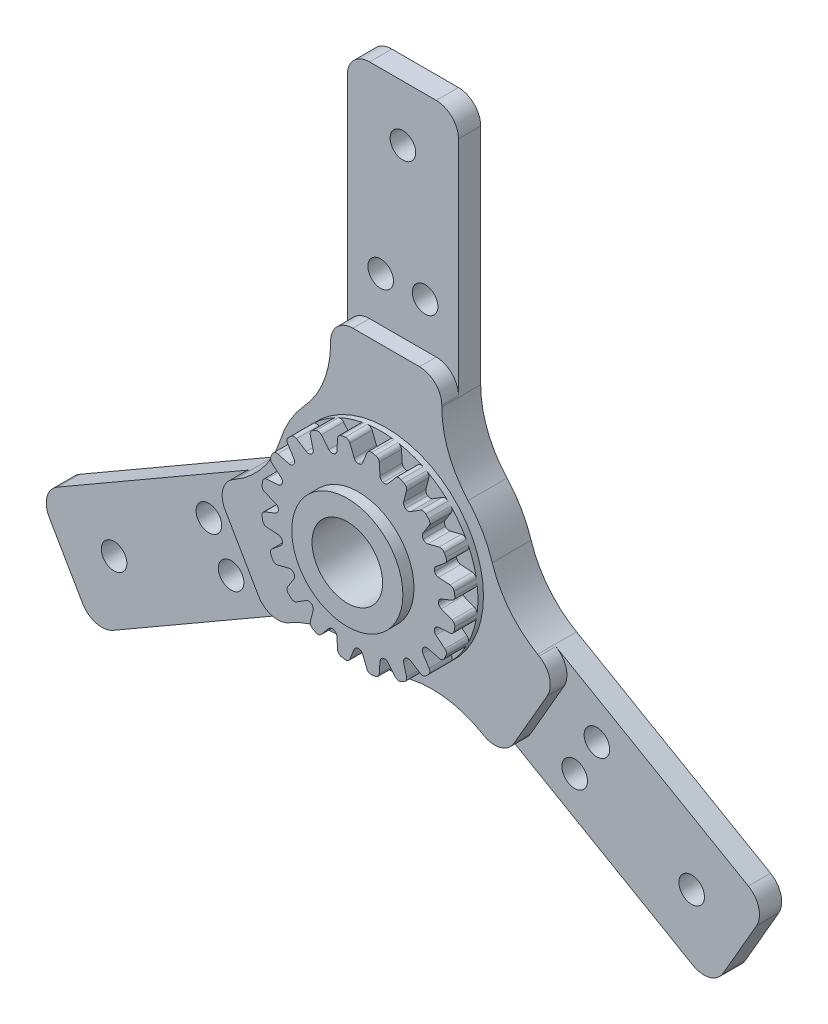
from build123d import *

# Parameters (mm, degrees)
SKETCH2_R          = 20
EXTRUDE2_DEPTH     = 7
SKETCH3_R          = 17.5
EXTRUDE3_DEPTH     = 5
SKETCH4_R          = 10
EXTRUDE4_DEPTH     = 2
SKETCH5_W          = 20
SKETCH5_H          = 69
EXTRUDE5_DEPTH     = 7
CIRPATTERN3_COUNT  = 3
FILLET1_R          = 18
CUT_EXTRUDE1_START = 4
SKETCH6_W          = 30
SKETCH6_H          = 45
CUT_EXTRUDE1_DEPTH = 7
CIRPATTERN4_COUNT  = 3
FILLET2_R          = 4
FILLET3_R          = 4
SKETCH7_R          = 2.3
CUT_EXTRUDE3_DEPTH = 7
CIRPATTERN5_COUNT  = 3
SKETCH9_R          = 6.35
CUT_EXTRUDE4_DEPTH = 16
CUT_EXTRUDE5_DEPTH = 4
CIRPATTERN6_COUNT  = 20
FILLET4_R          = 0.8


with BuildPart() as part:
    # Sketch2 → Extrude2 (new body)
    with BuildSketch(Plane.XY):
        Circle(SKETCH2_R)
    extrude(amount=EXTRUDE2_DEPTH)

    # Sketch3 → Extrude3 (add)
    with BuildSketch(Plane.XY.offset(7)):
        Circle(SKETCH3_R)
    extrude(amount=EXTRUDE3_DEPTH)

    # Sketch4 → Extrude4 (add)
    with BuildSketch(Plane.XY.offset(12)):
        Circle(SKETCH4_R)
    extrude(amount=EXTRUDE4_DEPTH)

    # Sketch5 → Extrude5 (add)
    with BuildSketch(Plane.XY):
        with Locations((0, 35.5)):
            Rectangle(SKETCH5_W, SKETCH5_H)
    extrude5 = extrude(amount=EXTRUDE5_DEPTH)

    # CirPattern3: Extrude5 ×3 about axis
    cirpattern3_axis = Axis((0, 0, 14), (0, 0, -1))
    for i in range(1, CIRPATTERN3_COUNT):
        add(extrude5.rotate(cirpattern3_axis, i * 360 / CIRPATTERN3_COUNT))

    # Fillet1
    fillet1_edges = [part.edges().sort_by_distance(p)[0] for p in [
        (-20, 0, 3.5),
        (-10, 17.320508076, 3.5),
        (10, 17.320508076, 3.5),
        (20, 0, 3.5),
        (10, -17.320508076, 3.5),
        (-10, -17.320508076, 3.5),
    ]]
    fillet(fillet1_edges, radius=FILLET1_R)

    # Sketch6 → Cut-Extrude1 (cut)
    with BuildSketch(Plane.XY.offset(CUT_EXTRUDE1_START)):
        with Locations((0, 52.5)):
            Rectangle(SKETCH6_W, SKETCH6_H)
    cut_extrude1 = extrude(amount=CUT_EXTRUDE1_DEPTH, mode=Mode.SUBTRACT)

    # CirPattern4: Cut-Extrude1 ×3 about axis
    cirpattern4_axis = Axis((0, 0, 14), (0, 0, -1))
    for i in range(1, CIRPATTERN4_COUNT):
        add(cut_extrude1.rotate(cirpattern4_axis, i * 360 / CIRPATTERN4_COUNT), mode=Mode.SUBTRACT)

    # Fillet2
    fillet2_edges = [part.edges().sort_by_distance(p)[0] for p in [
        (20.980762114, -23.660254038, 5.5),
        (30.980762114, -6.339745962, 5.5),
        (-30.980762114, -6.339745962, 5.5),
        (-20.980762114, -23.660254038, 5.5),
        (-10, 30, 5.5),
        (10, 30, 5.5),
    ]]
    fillet(fillet2_edges, radius=FILLET2_R)

    # Fillet3
    fillet3_edges = [part.edges().sort_by_distance(p)[0] for p in [
        (-55.621778265, -43.660254038, 2),
        (-65.621778265, -26.339745962, 2),
        (-10, 70, 2),
        (10, 70, 2),
        (55.621778265, -43.660254038, 2),
        (65.621778265, -26.339745962, 2),
    ]]
    fillet(fillet3_edges, radius=FILLET3_R)

    # Sketch7 → Cut-Extrude3 (cut)
    with BuildSketch(Plane.XY):
        with Locations((4, 38)):
            Circle(SKETCH7_R)
        with Locations((-4, 38)):
            Circle(SKETCH7_R)
        with Locations((0, 60)):
            Circle(SKETCH7_R)
    cut_extrude3 = extrude(amount=CUT_EXTRUDE3_DEPTH, mode=Mode.SUBTRACT)

    # CirPattern5: Cut-Extrude3 ×3 about axis
    cirpattern5_axis = Axis((0, 0, 14), (0, 0, -1))
    for i in range(1, CIRPATTERN5_COUNT):
        add(cut_extrude3.rotate(cirpattern5_axis, i * 360 / CIRPATTERN5_COUNT), mode=Mode.SUBTRACT)

    # Sketch9 → Cut-Extrude4 (cut)
    with BuildSketch(Plane.XY.offset(14)):
        Circle(SKETCH9_R)
    extrude(amount=-CUT_EXTRUDE4_DEPTH, mode=Mode.SUBTRACT)

    # Sketch10 → Cut-Extrude5 (cut)
    with BuildSketch(Plane.XY.offset(12)):
        Polygon((-2, 18), (2, 18), (0.56191856, 14.404006621), (-0.56191856, 14.404006621), align=None)
    cut_extrude5 = extrude(amount=-CUT_EXTRUDE5_DEPTH, mode=Mode.SUBTRACT)

    # CirPattern6: Cut-Extrude5 ×20 about axis
    cirpattern6_axis = Axis((0, 0, 14), (0, 0, -1))
    for i in range(1, CIRPATTERN6_COUNT):
        add(cut_extrude5.rotate(cirpattern6_axis, i * 360 / CIRPATTERN6_COUNT), mode=Mode.SUBTRACT)

    # Fillet4
    fillet4_edges = [part.edges().sort_by_distance(p)[0] for p in [
        (1.764383193, 17.410828583, 10),
        (0.56191856, 14.404006621, 10),
        (-0.56191856, 14.404006621, 10),
        (-1.764383193, 17.410828583, 10),
        (11.322798701, -8.92106433, 10),
        (11.983373586, -8.011861001, 10),
        (13.525381973, -4.985499141, 10),
        (13.872666742, -3.916666525, 10),
        (14.404006621, -0.56191856, 10),
        (14.404006621, 0.56191856, 10),
        (13.872666742, 3.916666525, 10),
        (13.525381973, 4.985499141, 10),
        (11.983373586, 8.011861001, 10),
        (11.322798701, 8.92106433, 10),
        (8.92106433, 11.322798701, 10),
        (8.011861001, 11.983373586, 10),
        (4.985499141, 13.525381973, 10),
        (3.916666525, 13.872666742, 10),
        (-3.916666525, 13.872666742, 10),
        (-4.985499141, 13.525381973, 10),
        (-8.011861001, 11.983373586, 10),
        (-8.92106433, 11.322798701, 10),
        (-11.322798701, 8.92106433, 10),
        (-11.983373586, 8.011861001, 10),
        (-13.525381973, 4.985499141, 10),
        (-13.872666742, 3.916666525, 10),
        (-17.410828583, 1.764383193, 10),
        (-14.404006621, 0.56191856, 10),
        (-14.404006621, -0.56191856, 10),
        (-17.410828583, -1.764383193, 10),
        (-17.103906369, -3.702213786, 10),
        (-13.872666742, -3.916666525, 10),
        (-13.525381973, -4.985499141, 10),
        (-16.013457587, -7.058270051, 10),
        (-15.12273463, -8.806412284, 10),
        (-11.983373586, -8.011861001, 10),
        (-11.322798701, -8.92106433, 10),
        (-13.04857779, -11.661244259, 10),
        (-11.661244259, -13.04857779, 10),
        (-8.92106433, -11.322798701, 10),
        (-8.011861001, -11.983373586, 10),
        (-8.806412284, -15.12273463, 10),
        (-7.058270051, -16.013457587, 10),
        (-4.985499141, -13.525381973, 10),
        (-3.916666525, -13.872666742, 10),
        (-3.702213786, -17.103906369, 10),
        (-1.764383193, -17.410828583, 10),
        (-0.56191856, -14.404006621, 10),
        (0.56191856, -14.404006621, 10),
        (1.764383193, -17.410828583, 10),
        (3.702213786, -17.103906369, 10),
        (3.916666525, -13.872666742, 10),
        (4.985499141, -13.525381973, 10),
        (8.011861001, -11.983373586, 10),
        (8.92106433, -11.322798701, 10),
        (7.058270051, -16.013457587, 10),
        (8.806412284, -15.12273463, 10),
        (11.661244259, -13.04857779, 10),
        (13.04857779, -11.661244259, 10),
        (15.12273463, -8.806412284, 10),
        (16.013457587, -7.058270051, 10),
        (17.103906369, -3.702213786, 10),
        (17.410828583, -1.764383193, 10),
        (17.410828583, 1.764383193, 10),
        (17.103906369, 3.702213786, 10),
        (16.013457587, 7.058270051, 10),
        (15.12273463, 8.806412284, 10),
        (-17.103906369, 3.702213786, 10),
        (-16.013457587, 7.058270051, 10),
        (-15.12273463, 8.806412284, 10),
        (-13.04857779, 11.661244259, 10),
        (-11.661244259, 13.04857779, 10),
        (-8.806412284, 15.12273463, 10),
        (-7.058270051, 16.013457587, 10),
        (-3.702213786, 17.103906369, 10),
        (3.702213786, 17.103906369, 10),
        (7.058270051, 16.013457587, 10),
        (8.806412284, 15.12273463, 10),
        (13.04857779, 11.661244259, 10),
        (11.661244259, 13.04857779, 10),
    ]]
    fillet(fillet4_edges, radius=FILLET4_R)


solid = part.part
